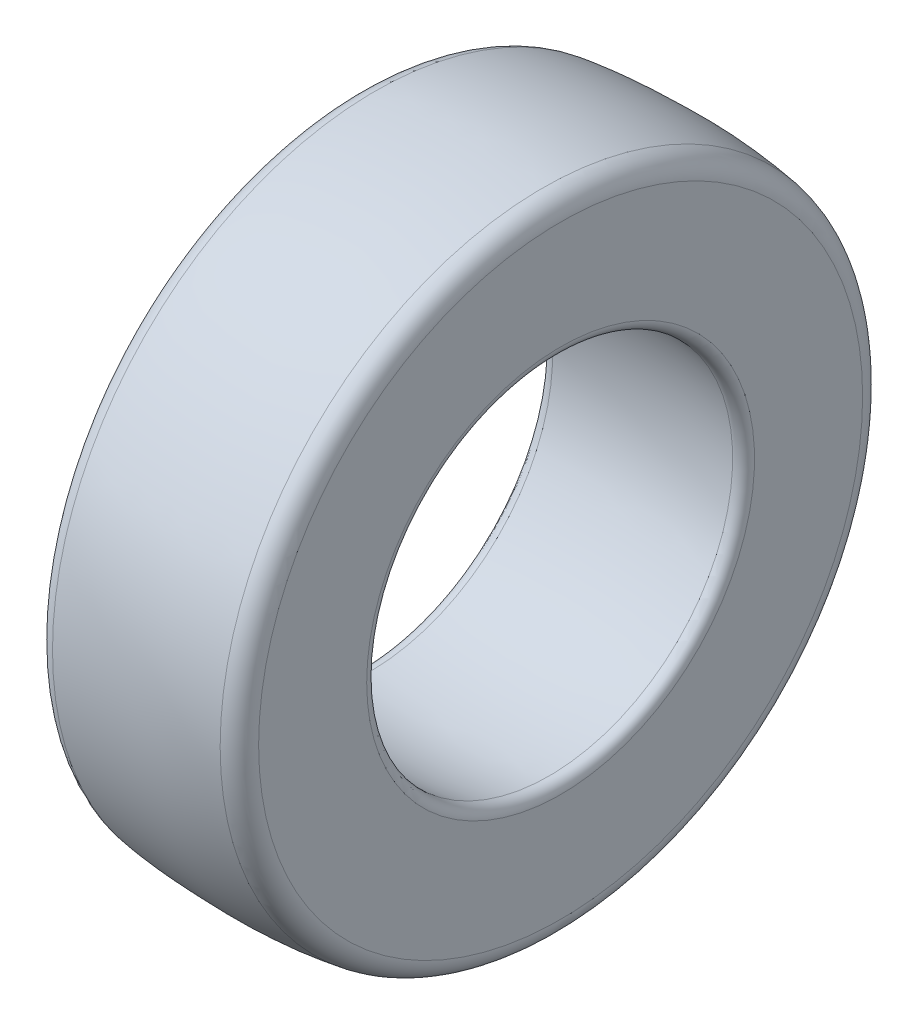
from build123d import *


with BuildPart() as part:
    # Balayage1: sweep along a path in Esquisse2
    with BuildLine(Plane(origin=(0, 0, 0), x_dir=(0, 0, -1), z_dir=(1, 0, 0))) as balayage1_path:
        CenterArc((0, -30.697276077), 18.08, 0, 360)
    # Esquisse1 → Balayage1 (sweep)
    with BuildSketch(Plane.XY):
        with BuildLine():
            Line((9.75, -1.705844805), (9.75, -12.080482835))
            ThreePointArc((9.75, -12.080482835), (9.418659658, -12.824051434), (8.644211477, -13.074871486))
            add(Edge.make_bspline(
                [(-8.639497918, -13.06789707), (-5.962658662, -12.770278108), (1.018950966, -12.480757929), (5.401157061, -12.729857554), (8.644211477, -13.074871486)],
                knots=[0.057340546, 0.057340546, 0.057340546, 0.057340546, 0.473274059, 0.946548119, 0.946548119, 0.946548119, 0.946548119], degree=3))
            ThreePointArc((-8.639497918, -13.06789707), (-9.416895013, -12.819172867), (-9.75, -12.074021177))
            Line((-9.75, -12.074021177), (-9.75, -1.69364433))
            ThreePointArc((-9.75, -1.69364433), (-9.265544866, -0.388606491), (-8.04687624, 0.284199066))
            add(Edge.make_bspline(
                [(-8.04687624, 0.284199066), (-5.709420251, 0.63505351), (1.539056453, 0.939568483), (5.000411491, 0.71370426), (8.036962294, 0.273461297)],
                knots=[0.08950135, 0.08950135, 0.08950135, 0.08950135, 0.457115955, 0.91423191, 0.91423191, 0.91423191, 0.91423191], degree=3))
            ThreePointArc((8.036962294, 0.273461297), (9.262270576, -0.397014141), (9.75, -1.705844805))
        make_face()
    sweep(path=balayage1_path.line)


solid = part.part
